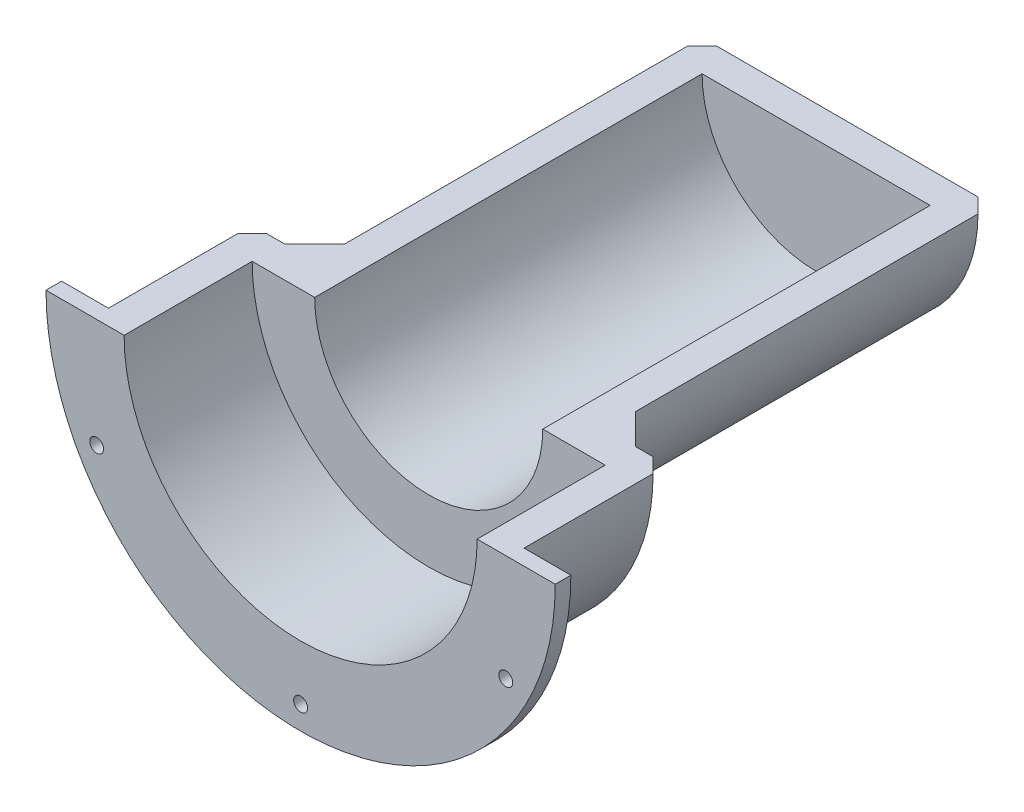
from build123d import *

# Parameters (mm, degrees)
BOSS_EXTRUDE1_DEPTH = 62.992
CUT_EXTRUDE1_DEPTH  = 57.912
BOSS_EXTRUDE2_DEPTH = 25.908
CUT_EXTRUDE2_DEPTH  = 25.908
CUT_EXTRUDE3_DEPTH  = 20.828
BOSS_EXTRUDE3_DEPTH = 2.54
CUT_EXTRUDE4_DEPTH  = 2.54
CHAMFER1_SIZE       = 4.92
CHAMFER3_SIZE       = 2.38
CHAMFER4_SIZE       = 2.38
SKETCH12_R          = 1.1303
CUT_EXTRUDE6_DEPTH  = 2.54
SKETCH16_R          = 1.1303
CUT_EXTRUDE7_DEPTH  = 2.54


with BuildPart() as part:
    # Sketch2 → Boss-Extrude1 (new body)
    with BuildSketch(Plane.XY):
        with BuildLine():
            Line((-23.622, 0), (23.622, 0))
            ThreePointArc((23.622, 0), (0, -23.622), (-23.622, 0))
        make_face()
    extrude(amount=-BOSS_EXTRUDE1_DEPTH)

    # Sketch3 → Cut-Extrude1 (cut)
    with BuildSketch(Plane.XY):
        with BuildLine():
            Line((-18.542, 0), (18.542, 0))
            ThreePointArc((18.542, 0), (0, -18.542), (-18.542, 0))
        make_face()
    extrude(amount=-CUT_EXTRUDE1_DEPTH, mode=Mode.SUBTRACT)

    # Sketch5 → Boss-Extrude2 (add)
    with BuildSketch(Plane.XY):
        with BuildLine():
            Line((-33.782, 0), (33.782, 0))
            ThreePointArc((33.782, 0), (0, -33.782), (-33.782, 0))
        make_face()
    extrude(amount=BOSS_EXTRUDE2_DEPTH)

    # Sketch6 → Cut-Extrude2 (cut)
    with BuildSketch(Plane.XY.offset(25.908)):
        with BuildLine():
            Line((-18.542, 0), (18.542, 0))
            ThreePointArc((18.542, 0), (0, -18.542), (-18.542, 0))
        make_face()
    extrude(amount=-CUT_EXTRUDE2_DEPTH, mode=Mode.SUBTRACT)

    # Sketch7 → Cut-Extrude3 (cut)
    with BuildSketch(Plane.XY.offset(25.908)):
        with BuildLine():
            Line((-28.702, 0), (28.702, 0))
            ThreePointArc((28.702, 0), (0, -28.702), (-28.702, 0))
        make_face()
    extrude(amount=-CUT_EXTRUDE3_DEPTH, mode=Mode.SUBTRACT)

    # Sketch9 → Boss-Extrude3 (add)
    with BuildSketch(Plane.XY.offset(25.908)):
        with BuildLine():
            Line((-41.402, 0), (41.402, 0))
            ThreePointArc((41.402, 0), (0, -41.402), (-41.402, 0))
        make_face()
    extrude(amount=-BOSS_EXTRUDE3_DEPTH)

    # Sketch10 → Cut-Extrude4 (cut)
    with BuildSketch(Plane.XY.offset(25.908)):
        with BuildLine():
            Line((-28.702, 0), (28.702, 0))
            ThreePointArc((28.702, 0), (0, -28.702), (-28.702, 0))
        make_face()
    extrude(amount=-CUT_EXTRUDE4_DEPTH, mode=Mode.SUBTRACT)

    # Chamfer1
    chamfer1_edges = [part.edges().sort_by_distance(p)[0] for p in [
        (0, -23.622, 0),
    ]]
    chamfer(chamfer1_edges, length=CHAMFER1_SIZE)

    # Chamfer3
    chamfer3_edges = [part.edges().sort_by_distance(p)[0] for p in [
        (0, -23.622, -62.992),
    ]]
    chamfer(chamfer3_edges, length=CHAMFER3_SIZE)

    # Chamfer4
    chamfer4_edges = [part.edges().sort_by_distance(p)[0] for p in [
        (0, -33.782, 0),
    ]]
    chamfer(chamfer4_edges, length=CHAMFER4_SIZE)

    # Sketch12 → Cut-Extrude6 (cut)
    with BuildSketch(Plane(origin=(0, 0, 23.368), x_dir=(-1, 0, 0), z_dir=(0, 0, -1))):
        with Locations((0, -37.592)):
            Circle(SKETCH12_R)
    extrude(amount=-CUT_EXTRUDE6_DEPTH, mode=Mode.SUBTRACT)

    # Sketch16 → Cut-Extrude7 (cut)
    with BuildSketch(Plane.XY.offset(25.908)):
        with Locations((-33.156425447, -17.714680792)):
            Circle(SKETCH16_R)
        with Locations((33.359405316, -17.329412596)):
            Circle(SKETCH16_R)
    extrude(amount=-CUT_EXTRUDE7_DEPTH, mode=Mode.SUBTRACT)


solid = part.part
